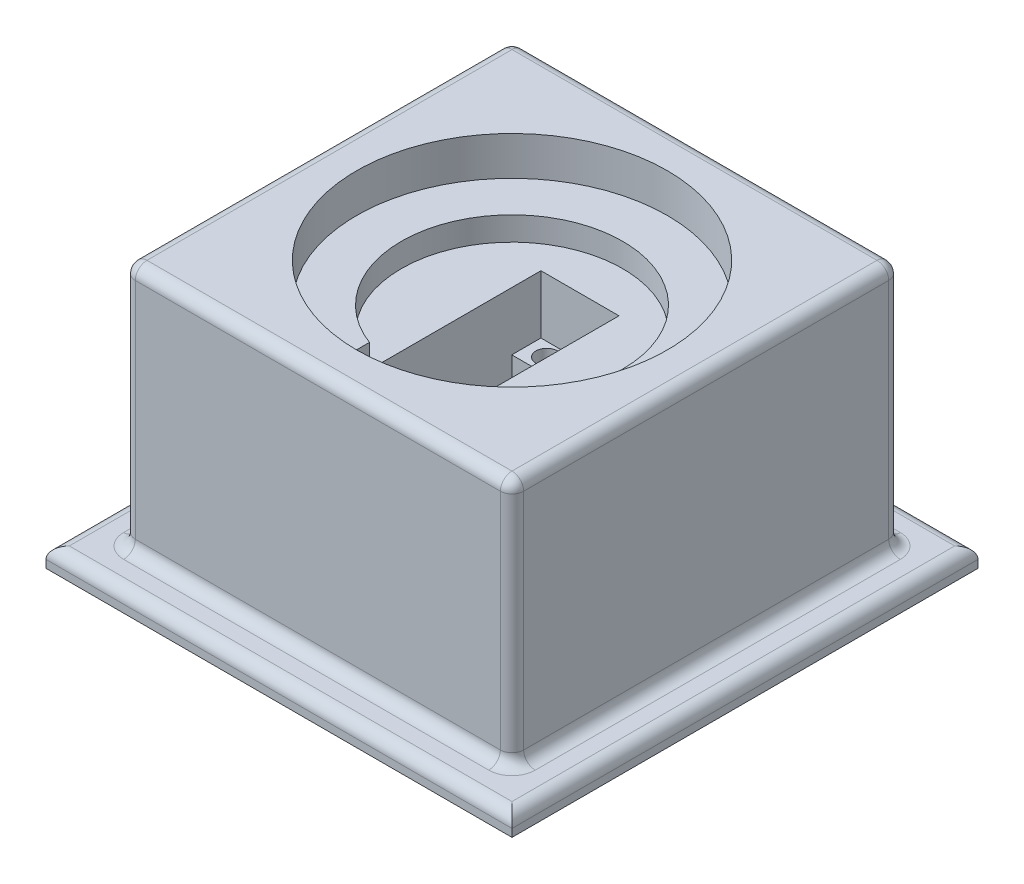
from build123d import *

# Parameters (mm, degrees)
SKETCH1_W               = 100
SKETCH1_H               = 100
BOSS_EXTRUDE1_DEPTH     = 68.7
SKETCH2_R               = 40
CUT_EXTRUDE1_DEPTH      = 10
SKETCH3_R               = 28.5
CUT_EXTRUDE2_DEPTH      = 6.1
CUT_EXTRUDE3_DEPTH      = 89.129223303
CUT_EXTRUDE3_DEPTH_BACK = 15.01
SKETCH4_W               = 20.11
SKETCH4_H               = 55.01
SKETCH5_W               = 20.11
SKETCH5_H               = 40.11
CUT_EXTRUDE4_DEPTH      = 27.51
CUT_EXTRUDE5_REACH      = 133.224
SKETCH7_R               = 2.775
CUT_EXTRUDE6_DEPTH      = 3.2
CUT_EXTRUDE7_DEPTH      = 5
SKETCH9_W               = 120
SKETCH9_H               = 120
BOSS_EXTRUDE2_DEPTH     = 5
FILLET2_R               = 3


with BuildPart() as part:
    # Sketch1 → Boss-Extrude1 (new body)
    with BuildSketch(Plane(origin=(0, 0, 0), x_dir=(1, 0, 0), z_dir=(0, 1, 0))):
        Rectangle(SKETCH1_W, SKETCH1_H)
    extrude(amount=BOSS_EXTRUDE1_DEPTH)

    # Sketch2 → Cut-Extrude1 (cut)
    with BuildSketch(Plane(origin=(0, 68.7, 0), x_dir=(1, 0, 0), z_dir=(0, 1, 0))):
        with Locations(Location((0, 0, 0), (0, 0, 270))):
            Circle(SKETCH2_R)
    extrude(amount=-CUT_EXTRUDE1_DEPTH, mode=Mode.SUBTRACT)

    # Sketch3 → Cut-Extrude2 (cut)
    with BuildSketch(Plane(origin=(0, 58.7, 0), x_dir=(1, 0, 0), z_dir=(0, 1, 0))):
        with Locations(Location((0, 0, 0), (0, 0, 270))):
            Circle(SKETCH3_R)
    extrude(amount=-CUT_EXTRUDE2_DEPTH, mode=Mode.SUBTRACT)

    # Sketch4 → Cut-Extrude3 (cut, two sides: drawn at the far end of the back side and taken through both)
    with BuildSketch(Plane(origin=(0, 52.6, 0), x_dir=(1, 0, 0), z_dir=(0, 1, 0)).offset(-CUT_EXTRUDE3_DEPTH_BACK)):
        with Locations((0, -10.005)):
            Rectangle(SKETCH4_W, SKETCH4_H)
    extrude(amount=CUT_EXTRUDE3_DEPTH + CUT_EXTRUDE3_DEPTH_BACK, mode=Mode.SUBTRACT)

    # Sketch5 → Cut-Extrude4 (cut)
    with BuildSketch(Plane(origin=(0, 37.59, 0), x_dir=(1, 0, 0), z_dir=(0, 1, 0))):
        with Locations((0, -10.055)):
            Rectangle(SKETCH5_W, SKETCH5_H)
    extrude(amount=-CUT_EXTRUDE4_DEPTH, mode=Mode.SUBTRACT)

    # Sketch6 → Cut-Extrude5 (cut, up to next)
    with BuildSketch(Plane(origin=(0, 0, -50), x_dir=(-1, 0, 0), z_dir=(0, 0, -1)), mode=Mode.PRIVATE) as cut_extrude5_sk1:
        with BuildLine():
            Line((-3.5, 13.08), (3.5, 13.08))
            Line((3.5, 13.08), (3.5, 17.58))
            ThreePointArc((3.5, 17.58), (0, 21.08), (-3.5, 17.58))
            Line((-3.5, 17.58), (-3.5, 13.08))
        make_face()
    cut_extrude5_tool1 = extrude(cut_extrude5_sk1.sketch, amount=-CUT_EXTRUDE5_REACH, mode=Mode.PRIVATE) & part.part
    add(cut_extrude5_tool1.solids().sort_by_distance((0, 16.746539, -50))[0], mode=Mode.SUBTRACT)

    # Sketch7 → Cut-Extrude6 (cut)
    with BuildSketch(Plane(origin=(0, 37.59, 0), x_dir=(1, 0, 0), z_dir=(0, 1, 0))):
        with Locations(Location((5.055, -34.01, 0), (0, 0, 270))):
            Circle(SKETCH7_R)
        with Locations(Location((-5.055, -34.01, 0), (0, 0, 270))):
            Circle(SKETCH7_R)
        with Locations(Location((-5.055, 14, 0), (0, 0, 270))):
            Circle(SKETCH7_R)
        with Locations(Location((5.055, 14, 0), (0, 0, 270))):
            Circle(SKETCH7_R)
    extrude(amount=-CUT_EXTRUDE6_DEPTH, mode=Mode.SUBTRACT)

    # Sketch8 → Cut-Extrude7 (cut)
    with BuildSketch(Plane.XY.offset(-10)):
        with BuildLine():
            Line((-3.5, 13.08), (3.5, 13.08))
            Line((3.5, 13.08), (3.5, 31.08))
            ThreePointArc((3.5, 31.08), (0, 34.58), (-3.5, 31.08))
            Line((-3.5, 31.08), (-3.5, 13.08))
        make_face()
    extrude(amount=-CUT_EXTRUDE7_DEPTH, mode=Mode.SUBTRACT)

    # Sketch9 → Boss-Extrude2 (add)
    with BuildSketch(Plane.XZ):
        Rectangle(SKETCH9_W, SKETCH9_H)
    extrude(amount=-BOSS_EXTRUDE2_DEPTH)

    # Fillet2
    fillet2_edges = [part.edges().sort_by_distance(p)[0] for p in [
        (-50, 5, 0),
        (50, 5, 0),
        (0, 5, 50),
        (60, 5, 0),
        (0, 5, -60),
        (-60, 5, 0),
        (0, 5, 60),
        (0, 5, -50),
        (0, 68.7, -50),
        (-50, 68.7, 0),
        (0, 68.7, 50),
        (-50, 36.85, 50),
        (-50, 36.85, -50),
        (50, 36.85, -50),
        (50, 36.85, 50),
        (50, 68.7, 0),
    ]]
    fillet(fillet2_edges, radius=FILLET2_R)


solid = part.part
